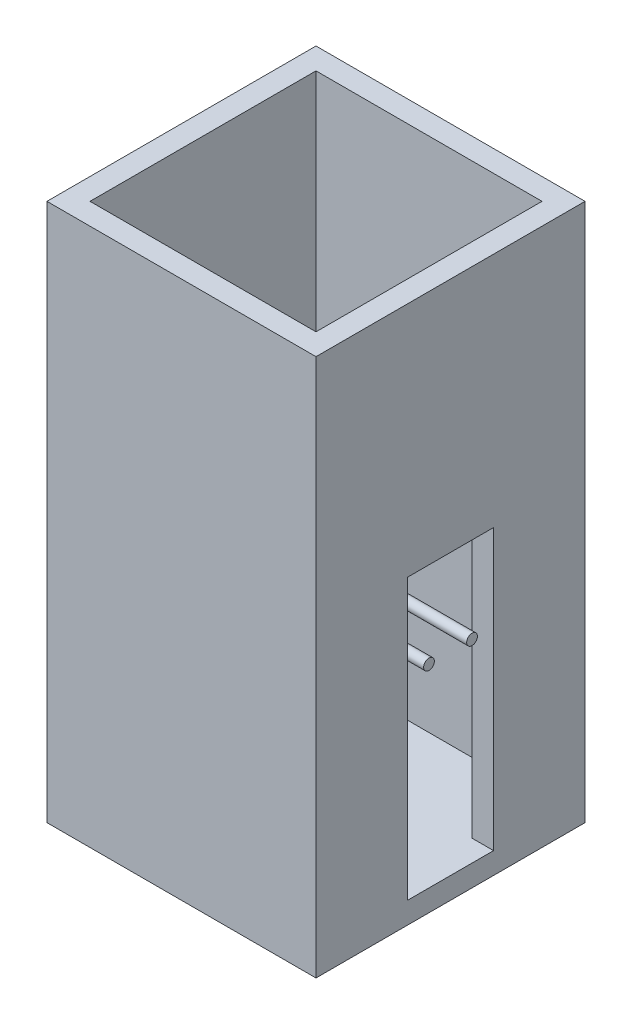
from build123d import *

# Parameters (mm, degrees)
SKETCH4_W           = 79.375
SKETCH4_H           = 79.375
BOSS_EXTRUDE3_DEPTH = 6.35
SKETCH5_W           = 79.375
SKETCH5_H           = 79.375
SKETCH5_W_2         = 66.675
SKETCH5_H_2         = 66.675
BOSS_EXTRUDE4_DEPTH = 152.4
SKETCH7_W           = 25.4
SKETCH7_H           = 82.55
CUT_EXTRUDE1_DEPTH  = 6.35
SKETCH8_R           = 1.5875
BOSS_EXTRUDE5_DEPTH = 73.025


with BuildPart() as part:
    # Sketch4 → Boss-Extrude3 (new body)
    with BuildSketch(Plane(origin=(0, 0, 0), x_dir=(1, 0, 0), z_dir=(0, 1, 0))):
        Rectangle(SKETCH4_W, SKETCH4_H)
    extrude(amount=BOSS_EXTRUDE3_DEPTH)

    # Sketch5 → Boss-Extrude4 (add)
    with BuildSketch(Plane(origin=(0, 6.35, 0), x_dir=(1, 0, 0), z_dir=(0, 1, 0))):
        Rectangle(SKETCH5_W, SKETCH5_H)
        Rectangle(SKETCH5_W_2, SKETCH5_H_2, mode=Mode.SUBTRACT)
    extrude(amount=BOSS_EXTRUDE4_DEPTH)

    # Sketch7 → Cut-Extrude1 (cut)
    with BuildSketch(Plane(origin=(39.6875, 0, 0), x_dir=(0, 0, -1), z_dir=(1, 0, 0))):
        with Locations((0, 47.625)):
            Rectangle(SKETCH7_W, SKETCH7_H)
    extrude(amount=-CUT_EXTRUDE1_DEPTH, mode=Mode.SUBTRACT)

    # Sketch8 → Boss-Extrude5 (add)
    with BuildSketch(Plane(origin=(-33.3375, 0, 0), x_dir=(0, 0, -1), z_dir=(1, 0, 0))):
        with Locations(Location((-6.35, 63.5, 0), (0, 0, 180))):
            Circle(SKETCH8_R)
        with Locations(Location((6.35, 63.5, 0), (0, 0, 180))):
            Circle(SKETCH8_R)
    extrude(amount=BOSS_EXTRUDE5_DEPTH)


solid = part.part
